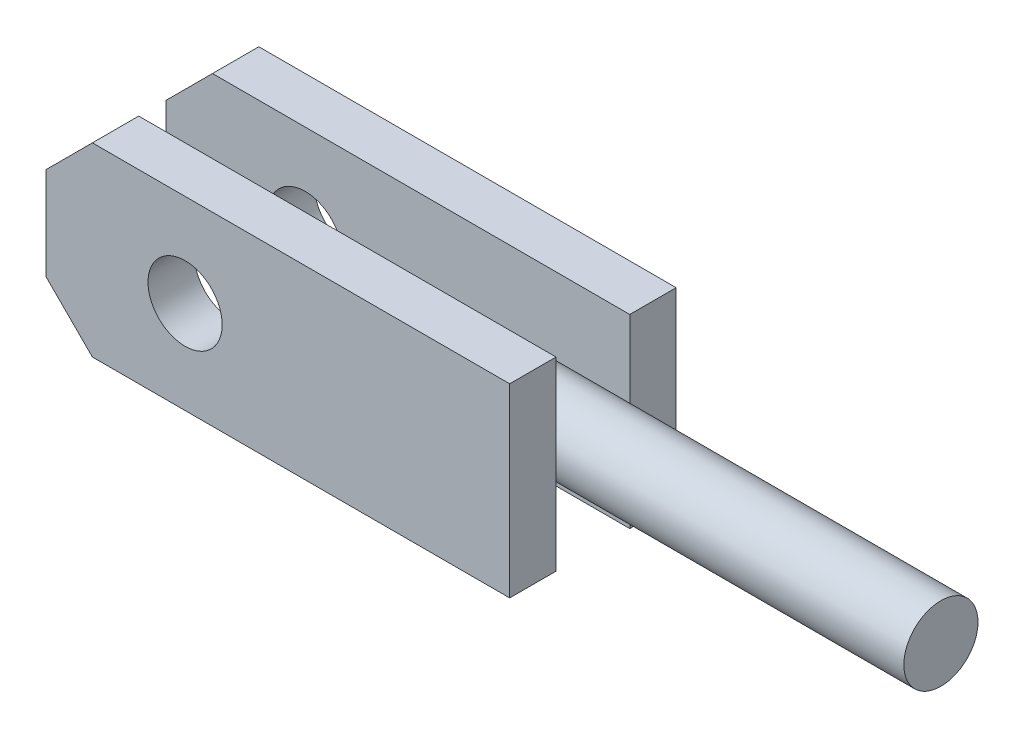
from build123d import *

# Parameters (mm, degrees)
SKETCH1_W                = 100
SKETCH1_H                = 40
BOSS_EXTRUDE1_DEPTH      = 10
SKETCH4_R                = 8
CUT_EXTRUDE1_DEPTH       = 10
CHAMFER2_SIZE            = 10
CHAMFER3_SIZE            = 10
BOSS_EXTRUDE2_DEPTH      = 75
BOSS_EXTRUDE2_DEPTH_BACK = 20
SKETCH5_R                = 8
LPATTERN1_COUNT          = 2
LPATTERN1_PITCH          = 25.9
CHAMFER4_SIZE            = 10
CHAMFER5_SIZE            = 10
CUT_EXTRUDE2_START       = -100
SKETCH6_R                = 8
CUT_EXTRUDE2_DEPTH       = 100


with BuildPart() as part:
    # Sketch1 → Boss-Extrude1 (new body)
    with BuildSketch(Plane.XY):
        Rectangle(SKETCH1_W, SKETCH1_H)
    boss_extrude1 = extrude(amount=BOSS_EXTRUDE1_DEPTH)

    # Sketch4 → Cut-Extrude1 (cut)
    with BuildSketch(Plane.XY.offset(10)):
        with Locations((-20, 0)):
            Circle(SKETCH4_R)
    extrude(amount=-CUT_EXTRUDE1_DEPTH, mode=Mode.SUBTRACT)

    # Chamfer2
    chamfer2_edges = [part.edges().sort_by_distance(p)[0] for p in [
        (-50, 20, 5),
    ]]
    chamfer(chamfer2_edges, length=CHAMFER2_SIZE)

    # Chamfer3
    chamfer3_edges = [part.edges().sort_by_distance(p)[0] for p in [
        (-50, -20, 5),
    ]]
    chamfer(chamfer3_edges, length=CHAMFER3_SIZE)


with BuildPart() as body_2:
    # Sketch5 → Boss-Extrude2 (new, two sides: drawn at the far end of the back side and taken through both)
    with BuildSketch(Plane(origin=(50, 0, 0), x_dir=(0, 0, -1), z_dir=(1, 0, 0)).offset(-BOSS_EXTRUDE2_DEPTH_BACK)):
        with Locations((8, 0)):
            Circle(SKETCH5_R)
    extrude(amount=BOSS_EXTRUDE2_DEPTH + BOSS_EXTRUDE2_DEPTH_BACK)

    # LPattern1: Boss-Extrude1 ×2
    with Locations(*[(0, 0, -i * LPATTERN1_PITCH) for i in range(1, LPATTERN1_COUNT)]):
        add(boss_extrude1)

    # Chamfer4
    chamfer4_edges = [body_2.edges().sort_by_distance(p)[0] for p in [
        (-50, 20, -20.9),
    ]]
    chamfer(chamfer4_edges, length=CHAMFER4_SIZE)

    # Chamfer5
    chamfer5_edges = [body_2.edges().sort_by_distance(p)[0] for p in [
        (-50, -20, -20.9),
    ]]
    chamfer(chamfer5_edges, length=CHAMFER5_SIZE)

    # Sketch6 → Cut-Extrude2 (cut)
    with BuildSketch(Plane(origin=(0, 0, -25.9), x_dir=(-1, 0, 0), z_dir=(0, 0, -1)).offset(CUT_EXTRUDE2_START)):
        with Locations((20, 0)):
            Circle(SKETCH6_R)
    extrude(amount=CUT_EXTRUDE2_DEPTH, mode=Mode.SUBTRACT)


solid = Compound([part.part, body_2.part])
